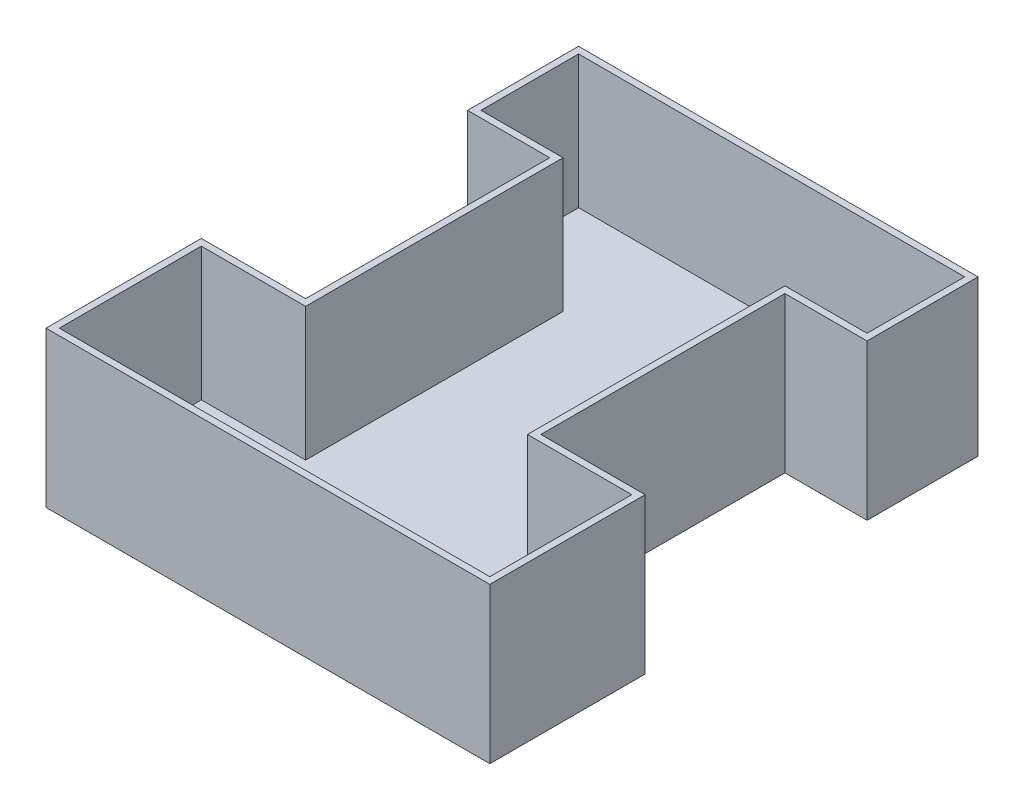
from build123d import *

# Parameters (mm, degrees)
BOSS_EXTRUDE1_DEPTH = 60
BOSS_EXTRUDE2_DEPTH = 10


with BuildPart() as part:
    # Sketch1 → Boss-Extrude1 (new body)
    with BuildSketch(Plane(origin=(0, 0, 0), x_dir=(1, 0, 0), z_dir=(0, 1, 0))):
        Polygon((72.260273973, 79.863013699), (-107.739726027, 79.863013699), (-107.739726027, 29.863013699), (-70.739726027, 29.863013699), (-70.739726027, -80.136986301), (-117.739726027, -80.136986301), (-117.739726027, -150.136986301), (82.260273973, -150.136986301), (82.260273973, -80.136986301), (35.260273973, -80.136986301), (35.260273973, 29.863013699), (72.260273973, 29.863013699), align=None)
        Polygon((69.260273973, 76.863013699), (-104.739726027, 76.863013699), (-104.739726027, 32.863013699), (-67.739726027, 32.863013699), (-67.739726027, -83.136986301), (-114.739726027, -83.136986301), (-114.739726027, -147.136986301), (79.260273973, -147.136986301), (79.260273973, -83.136986301), (32.260273973, -83.136986301), (32.260273973, 32.863013699), (69.260273973, 32.863013699), align=None, mode=Mode.SUBTRACT)
    extrude(amount=BOSS_EXTRUDE1_DEPTH)

    # Sketch2 → Boss-Extrude2 (add)
    with BuildSketch(Plane(origin=(0, 0, 0), x_dir=(1, 0, 0), z_dir=(0, 1, 0))):
        Polygon((72.260273973, 29.863013699), (72.260273973, 79.863013699), (-107.739726027, 79.863013699), (-107.739726027, 29.863013699), (-70.739726027, 29.863013699), (-70.739726027, -80.136986301), (-117.739726027, -80.136986301), (-117.739726027, -150.136986301), (82.260273973, -150.136986301), (82.260273973, -80.136986301), (35.260273973, -80.136986301), (35.260273973, 29.863013699), align=None)
    extrude(amount=-BOSS_EXTRUDE2_DEPTH)


solid = part.part
